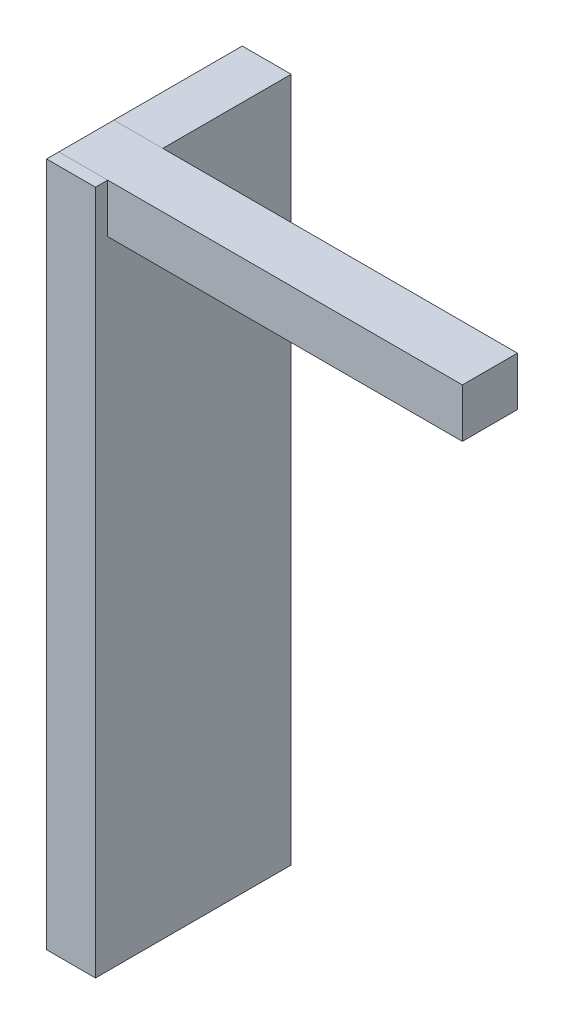
from build123d import *

# Parameters (mm, degrees)
COLUMN_START       = 46
SKETCH1_W          = 16
SKETCH1_H          = 56
COLUMN_DEPTH       = 4
ANCHOR_PLATE_START = 46
SKETCH2_W          = 4.5
SKETCH2_H          = 4
ANCHOR_PLATE_DEPTH = 33


with BuildPart() as part:
    # Sketch1 → column (new body)
    with BuildSketch(Plane(origin=(0, 0, 0), x_dir=(0, 0, -1), z_dir=(1, 0, 0)).offset(COLUMN_START)):
        with Locations((-32, 220)):
            Rectangle(SKETCH1_W, SKETCH1_H)
    extrude(amount=COLUMN_DEPTH)


with BuildPart() as body_2:
    # Sketch2 → anchor_plate (new body)
    with BuildSketch(Plane(origin=(0, 0, 0), x_dir=(0, 0, -1), z_dir=(1, 0, 0)).offset(ANCHOR_PLATE_START)):
        with Locations((-36.75, 246)):
            Rectangle(SKETCH2_W, SKETCH2_H)
    extrude(amount=ANCHOR_PLATE_DEPTH)


solid = Compound([part.part, body_2.part])
